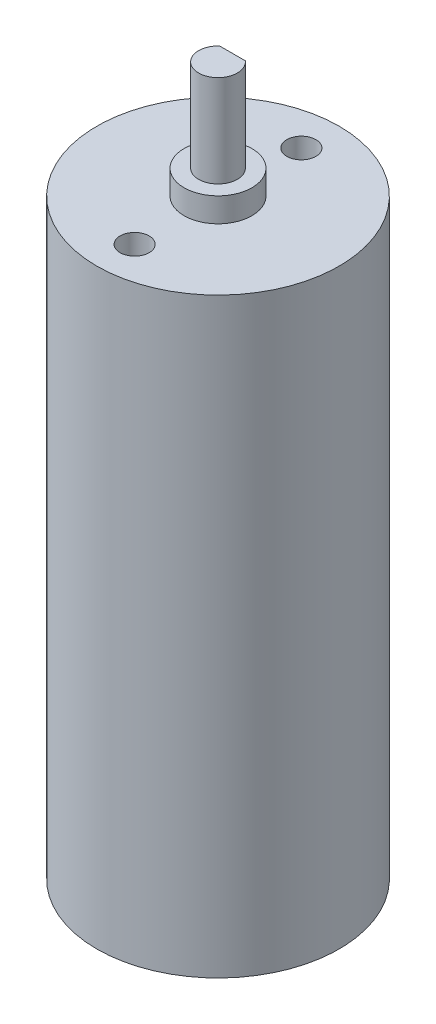
from build123d import *

# Parameters (mm, degrees)
SKETCH1_R           = 12.5
BOSS_EXTRUDE1_DEPTH = 61
SKETCH2_R           = 3.5
BOSS_EXTRUDE2_DEPTH = 2.5
SKETCH3_R           = 2
BOSS_EXTRUDE3_DEPTH = 1.5
BOSS_EXTRUDE4_DEPTH = 8
SKETCH5_R           = 1.5
CUT_EXTRUDE1_DEPTH  = 3


with BuildPart() as part:
    # Sketch1 → Boss-Extrude1 (new body)
    with BuildSketch(Plane(origin=(0, 0, 0), x_dir=(1, 0, 0), z_dir=(0, 1, 0))):
        with Locations(Location((0, 0, 0), (0, 0, 90))):
            Circle(SKETCH1_R)
    extrude(amount=BOSS_EXTRUDE1_DEPTH)

    # Sketch2 → Boss-Extrude2 (add)
    with BuildSketch(Plane(origin=(0, 61, 0), x_dir=(1, 0, 0), z_dir=(0, 1, 0))):
        with Locations(Location((0, 0, 0), (0, 0, 270))):
            Circle(SKETCH2_R)
    extrude(amount=BOSS_EXTRUDE2_DEPTH)

    # Sketch3 → Boss-Extrude3 (add)
    with BuildSketch(Plane(origin=(0, 63.5, 0), x_dir=(1, 0, 0), z_dir=(0, 1, 0))):
        with Locations(Location((0, 0, 0), (0, 0, 270))):
            Circle(SKETCH3_R)
    extrude(amount=BOSS_EXTRUDE3_DEPTH)

    # Sketch4 → Boss-Extrude4 (add)
    with BuildSketch(Plane(origin=(0, 65, 0), x_dir=(1, 0, 0), z_dir=(0, 1, 0))):
        with BuildLine():
            Line((-1.322876, 1.5), (1.322876, 1.5))
            ThreePointArc((1.322876, 1.5), (0, -2), (-1.322876, 1.5))
        make_face()
    extrude(amount=BOSS_EXTRUDE4_DEPTH)

    # Sketch5 → Cut-Extrude1 (cut)
    with BuildSketch(Plane(origin=(0, 61, 0), x_dir=(1, 0, 0), z_dir=(0, 1, 0))):
        with Locations(Location((0, 8.6, 0), (0, 0, 270))):
            Circle(SKETCH5_R)
        with Locations(Location((0, -8.6, 0), (0, 0, 270))):
            Circle(SKETCH5_R)
    extrude(amount=-CUT_EXTRUDE1_DEPTH, mode=Mode.SUBTRACT)


solid = part.part
